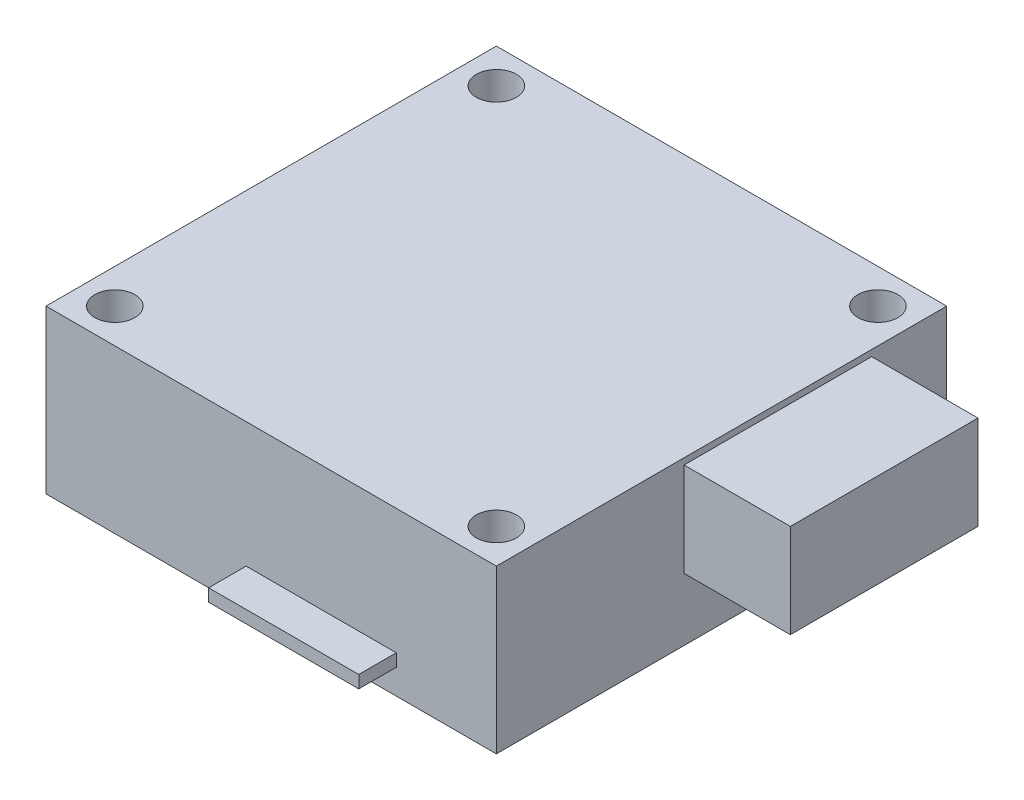
from build123d import *

# Parameters (mm, degrees)
SKETCH1_W           = 36
SKETCH1_H           = 36
SKETCH1_R           = 1.6
BOSS_EXTRUDE1_DEPTH = 13
SKETCH2_W           = 15
SKETCH2_H           = 7.5
BOSS_EXTRUDE2_DEPTH = 8.5
SKETCH3_W           = 12
SKETCH3_H           = 1
BOSS_EXTRUDE3_DEPTH = 3


with BuildPart() as part:
    # Sketch1 → Boss-Extrude1 (new body)
    with BuildSketch(Plane(origin=(0, 0, 0), x_dir=(1, 0, 0), z_dir=(0, 1, 0))):
        Rectangle(SKETCH1_W, SKETCH1_H)
        with Locations(Location((-15.25, 15.25, 0), (0, 0, 90))):
            Circle(SKETCH1_R, mode=Mode.SUBTRACT)
        with Locations(Location((15.25, 15.25, 0), (0, 0, 90))):
            Circle(SKETCH1_R, mode=Mode.SUBTRACT)
        with Locations(Location((15.25, -15.25, 0), (0, 0, 90))):
            Circle(SKETCH1_R, mode=Mode.SUBTRACT)
        with Locations(Location((-15.25, -15.25, 0), (0, 0, 90))):
            Circle(SKETCH1_R, mode=Mode.SUBTRACT)
    extrude(amount=BOSS_EXTRUDE1_DEPTH)

    # Sketch2 → Boss-Extrude2 (add)
    with BuildSketch(Plane(origin=(18, 0, 0), x_dir=(0, 0, -1), z_dir=(1, 0, 0))):
        with Locations((4.5, 8.75)):
            Rectangle(SKETCH2_W, SKETCH2_H)
    extrude(amount=BOSS_EXTRUDE2_DEPTH)

    # Sketch3 → Boss-Extrude3 (add)
    with BuildSketch(Plane.XY.offset(18)):
        with Locations((4, 2.5)):
            Rectangle(SKETCH3_W, SKETCH3_H)
    extrude(amount=BOSS_EXTRUDE3_DEPTH)


solid = part.part
